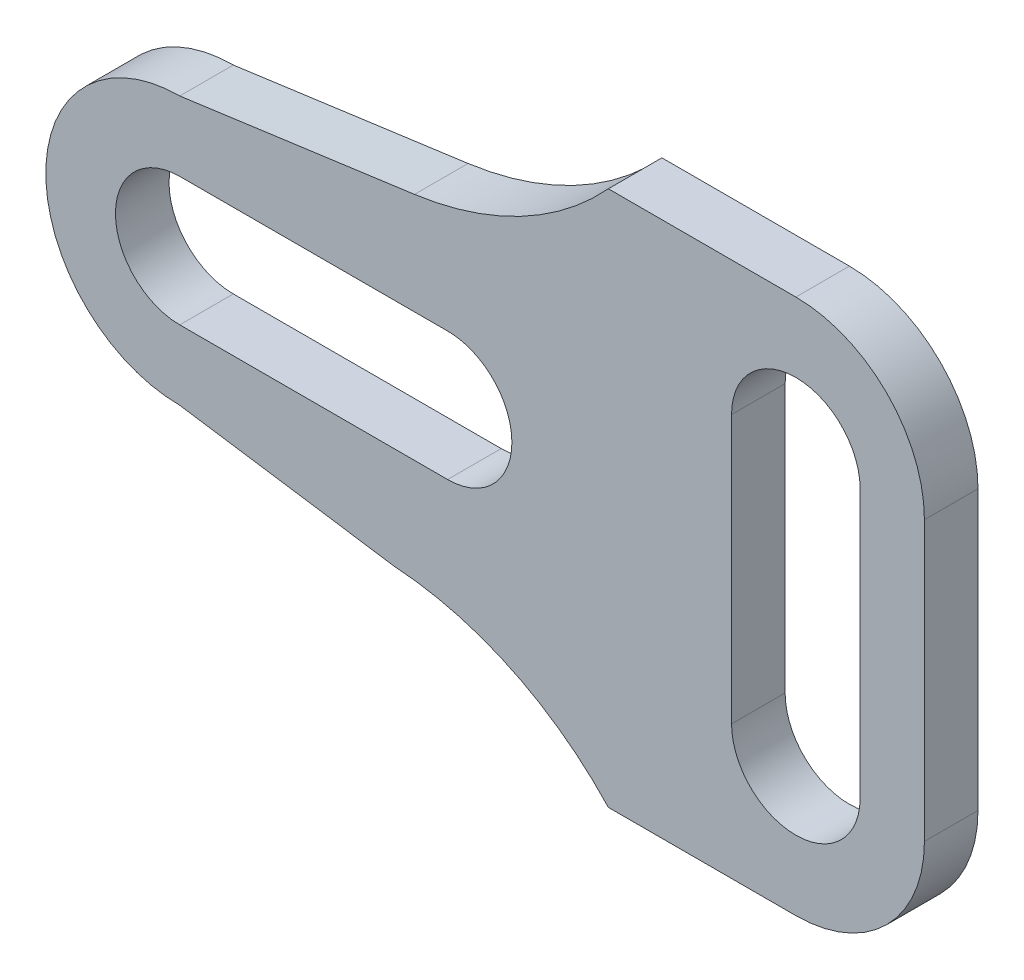
from build123d import *

# Parameters (mm, degrees)
BOSS_EXTRUDE1_DEPTH = 50


with BuildPart() as part:
    # Sketch1 → Boss-Extrude1 (new body)
    with BuildSketch(Plane.XY):
        with BuildLine():
            Line((-175, 353.543476539), (0, 353.543476539))
            ThreePointArc((0, 353.543476539), (84.852813742, 318.396290281), (120, 233.543476539))
            Line((120, 233.543476539), (120, -26.456523461))
            ThreePointArc((120, -26.456523461), (84.852813742, -111.309337204), (0, -146.456523461))
            Line((0, -146.456523461), (-175, -146.456523461))
            ThreePointArc((-175, -146.456523461), (-265.915006149, -79.830220617), (-375, -51.456523461))
            Line((-375, -51.456523461), (-575, -21.456523461))
            ThreePointArc((-575, -21.456523461), (-700, 103.543476539), (-575, 228.543476539))
            Line((-575, 228.543476539), (-355.89794699, 258.543476539))
            ThreePointArc((-355.89794699, 258.543476539), (-257.111916312, 290.168144661), (-175, 353.543476539))
        make_face()
        with BuildLine():
            Line((60, 228.543476539), (60, -21.456523461))
            ThreePointArc((60, -21.456523461), (0, -81.456523461), (-60, -21.456523461))
            Line((-60, -21.456523461), (-60, 228.543476539))
            ThreePointArc((-60, 228.543476539), (0, 288.543476539), (60, 228.543476539))
        make_face(mode=Mode.SUBTRACT)
        with BuildLine():
            Line((-325, 43.543476539), (-575, 43.543476539))
            ThreePointArc((-575, 43.543476539), (-635, 103.543476539), (-575, 163.543476539))
            Line((-575, 163.543476539), (-325, 163.543476539))
            ThreePointArc((-325, 163.543476539), (-265, 103.543476539), (-325, 43.543476539))
        make_face(mode=Mode.SUBTRACT)
    extrude(amount=BOSS_EXTRUDE1_DEPTH)


solid = part.part
